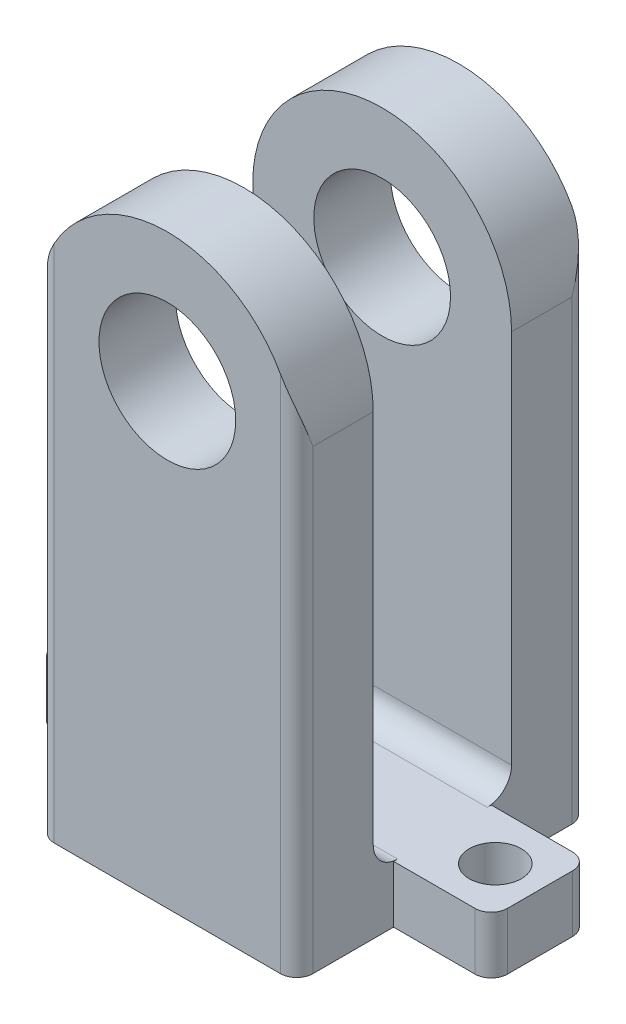
from build123d import *

# Parameters (mm, degrees)
HOLES1_R           = 1.6
HOLES_DEPTH        = 3.5
HOLES_2_DEPTH      = 3.5
BOSS_EXTRUDE_DEPTH = 36
CUT_EXTRUDE1_DEPTH = 44.077981615
HOLE2_R            = 4.2
CUT_EXTRUDE2_DEPTH = 43.555992527


with BuildPart() as part:
    # Holes1 → Holes (new body)
    with BuildSketch(Plane(origin=(0, 0, 0), x_dir=(1, 0, 0), z_dir=(0, 1, 0))):
        with BuildLine():
            Line((-12.95, -3), (-7.95, -3))
            Line((-7.95, -3), (-7.95, 3))
            Line((-7.95, 3), (-12.95, 3))
            ThreePointArc((-12.95, 3), (-13.657106781, 2.707106781), (-13.95, 2))
            Line((-13.95, 2), (-13.95, -2))
            ThreePointArc((-13.95, -2), (-13.657106781, -2.707106781), (-12.95, -3))
        make_face()
        with Locations((-11.2, 0)):
            Circle(HOLES1_R, mode=Mode.SUBTRACT)
    extrude(amount=HOLES_DEPTH)



with BuildPart() as body_2:
    # Holes1 → Holes 2 (new body)
    with BuildSketch(Plane(origin=(0, 0, 0), x_dir=(1, 0, 0), z_dir=(0, 1, 0))):
        with BuildLine():
            Line((7.95, 3), (7.95, -3))
            Line((7.95, -3), (12.95, -3))
            ThreePointArc((12.95, -3), (13.657106781, -2.707106781), (13.95, -2))
            Line((13.95, -2), (13.95, 2))
            ThreePointArc((13.95, 2), (13.657106781, 2.707106781), (12.95, 3))
            Line((12.95, 3), (7.95, 3))
        make_face()
        with Locations((11.2, 0)):
            Circle(HOLES1_R, mode=Mode.SUBTRACT)
    extrude(amount=HOLES_2_DEPTH)


with BuildPart() as part_1:
    add(part.part)

    add(body_2.part)  # Boss-Extrude merges body 2
    # Sketch<3> → Boss-Extrude (add)
    with BuildSketch(Plane(origin=(0, 0, 0), x_dir=(1, 0, 0), z_dir=(0, 1, 0))):
        with BuildLine():
            Line((6.95, 8.95), (-6.95, 8.95))
            ThreePointArc((-6.95, 8.95), (-7.657106781, 8.657106781), (-7.95, 7.95))
            Line((-7.95, 7.95), (-7.95, -7.95))
            ThreePointArc((-7.95, -7.95), (-7.657106781, -8.657106781), (-6.95, -8.95))
            Line((-6.95, -8.95), (6.95, -8.95))
            ThreePointArc((6.95, -8.95), (7.657106781, -8.657106781), (7.95, -7.95))
            Line((7.95, -7.95), (7.95, 7.95))
            ThreePointArc((7.95, 7.95), (7.657106781, 8.657106781), (6.95, 8.95))
        make_face()
    extrude(amount=BOSS_EXTRUDE_DEPTH)

    # CUT → Cut-Extrude1 (cut, through all)
    with BuildSketch(Plane.ZY.offset(7.95)):
        with BuildLine():
            Line((-4.25, 36), (4.25, 36))
            Line((4.25, 36), (4.25, 5))
            ThreePointArc((4.25, 5), (3.810660172, 3.939339828), (2.75, 3.5))
            Line((2.75, 3.5), (-2.75, 3.5))
            ThreePointArc((-2.75, 3.5), (-3.810660172, 3.939339828), (-4.25, 5))
            Line((-4.25, 5), (-4.25, 36))
        make_face()
    extrude(amount=-CUT_EXTRUDE1_DEPTH, mode=Mode.SUBTRACT)

    # Hole2 → Cut-Extrude2 (cut, through all)
    with BuildSketch(Plane.XY.offset(8.95)):
        with BuildLine():
            Line((-7.95, 36), (-7.95, 28.05))
            ThreePointArc((-7.95, 28.05), (-5.62149891, 33.67149891), (0, 36))
            Line((0, 36), (-7.95, 36))
        make_face()
        with BuildLine():
            ThreePointArc((0, 36), (5.62149891, 33.67149891), (7.95, 28.05))
            Line((7.95, 28.05), (7.95, 36))
            Line((7.95, 36), (0, 36))
        make_face()
        with Locations((0, 28.05)):
            Circle(HOLE2_R)
    extrude(amount=-CUT_EXTRUDE2_DEPTH, mode=Mode.SUBTRACT)


solid = part_1.part
